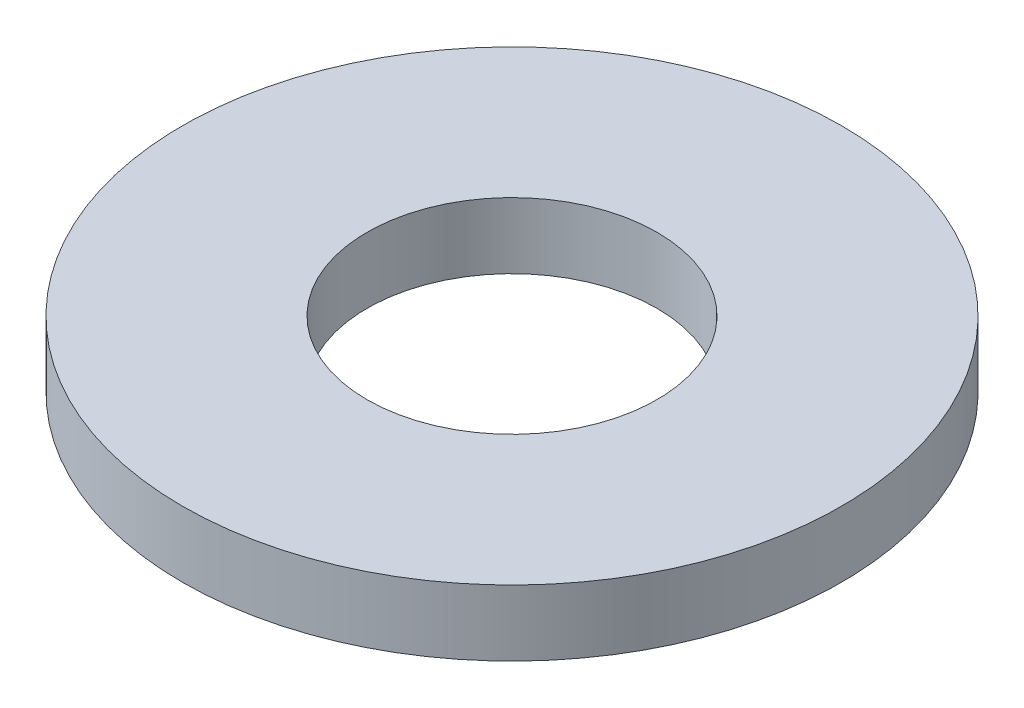
from build123d import *

# Parameters (mm, degrees)
ESQUISSE1_R        = 2.5
ESQUISSE1_R_2      = 1.1
BOSS_EXTRU_1_DEPTH = 0.25


with BuildPart() as part:
    # Esquisse1 → Boss.-Extru.1 (new, symmetric)
    with BuildSketch(Plane(origin=(0, 0, 0), x_dir=(1, 0, 0), z_dir=(0, 1, 0))):
        with Locations(Location((0, 0, 0), (0, 0, 270))):
            Circle(ESQUISSE1_R)
        with Locations(Location((0, 0, 0), (0, 0, 270))):
            Circle(ESQUISSE1_R_2, mode=Mode.SUBTRACT)
    extrude(amount=BOSS_EXTRU_1_DEPTH, both=True)


solid = part.part
